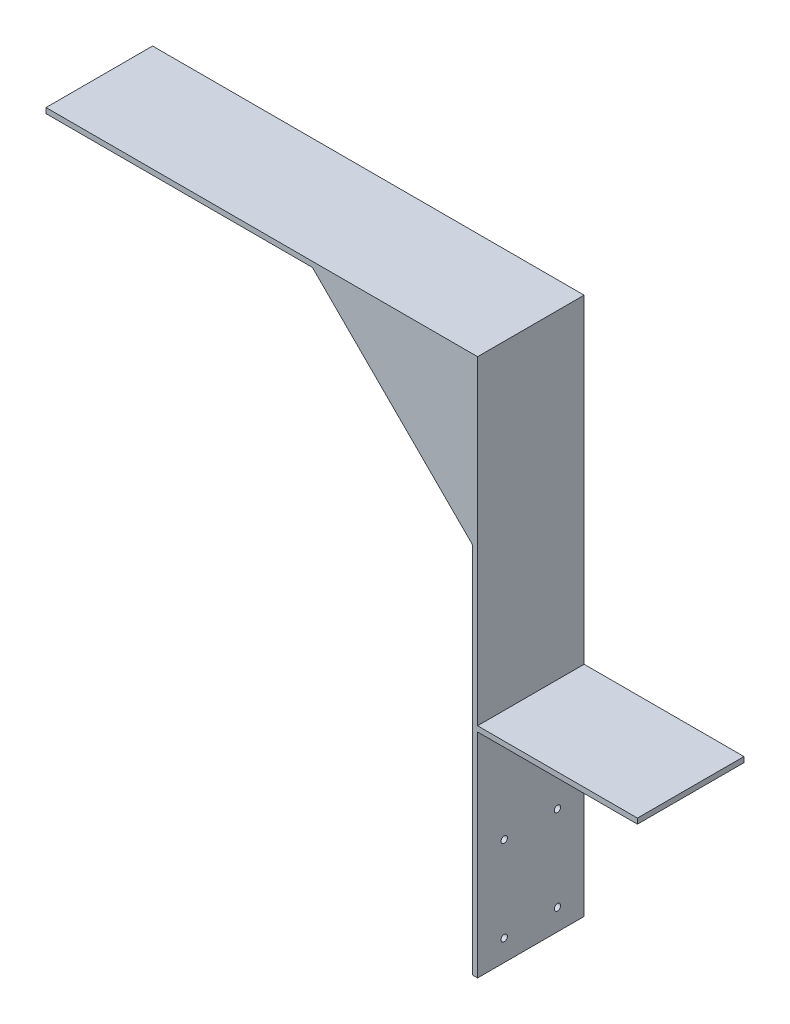
from build123d import *

# Parameters (mm, degrees)
EXTRUDE_THIN1_DEPTH   = 100
F_6_0MM_DOWEL_HOLE1_D = 6
SKETCH8_W             = 100
SKETCH8_H             = 5
BOSS_EXTRUDE3_DEPTH   = 150
BOSS_EXTRUDE4_DEPTH   = 5


with BuildPart() as part:
    # Sketch1 → Extrude-Thin1 (new body)
    with BuildSketch(Plane.XY):
        Polygon((0, 0), (0, 500), (-400, 500), (-400, 505), (5, 505), (5, 0), align=None)
    extrude(amount=EXTRUDE_THIN1_DEPTH)

    # Ø6.0mm Dowel Hole1 (through all)
    with Locations(Plane(origin=(5, 0, 0), x_dir=(0, 0, -1), z_dir=(1, 0, 0))):
        with Locations((-25, 100), (-75, 100), (-75, 20), (-25, 20)):
            Hole(F_6_0MM_DOWEL_HOLE1_D / 2)

    # Sketch8 → Boss-Extrude3 (add)
    with BuildSketch(Plane(origin=(5, 0, 0), x_dir=(0, 0, -1), z_dir=(1, 0, 0))):
        with Locations((-50, 202.5)):
            Rectangle(SKETCH8_W, SKETCH8_H)
    extrude(amount=BOSS_EXTRUDE3_DEPTH)

    # Sketch9 → Boss-Extrude4 (add)
    with BuildSketch(Plane.XY.offset(100)):
        Polygon((-150, 500), (0, 350), (0, 500), align=None)
    extrude(amount=-BOSS_EXTRUDE4_DEPTH)


solid = part.part
